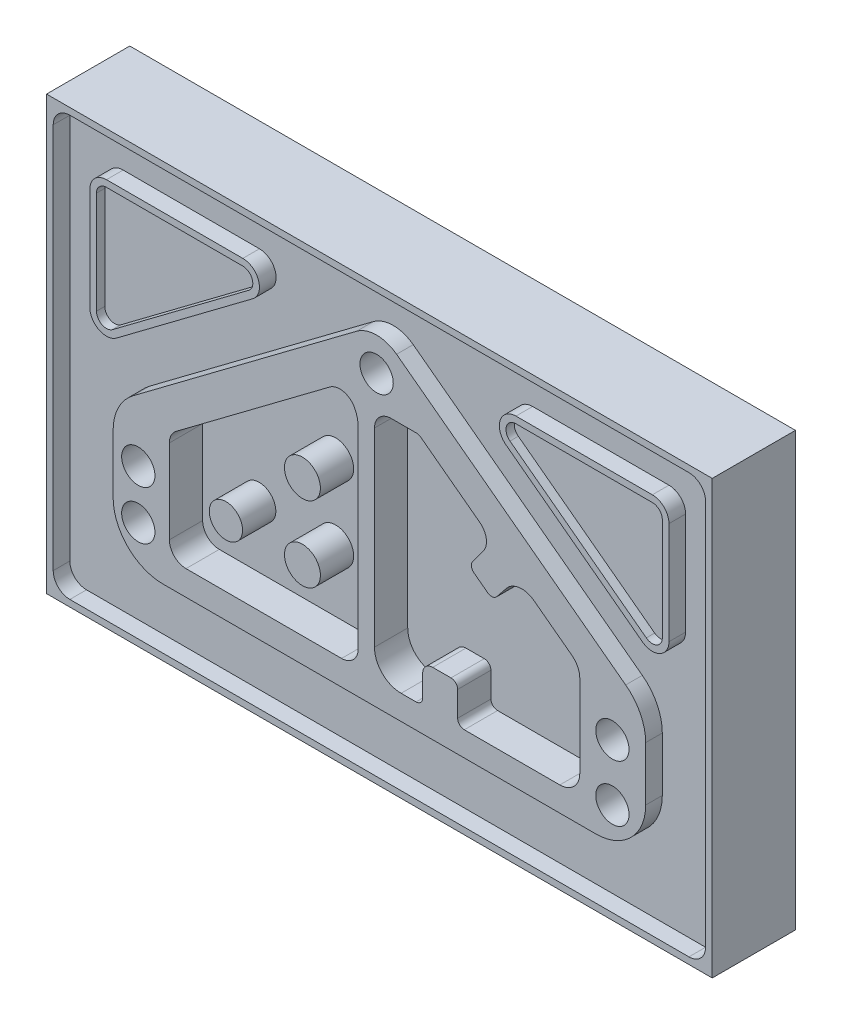
from build123d import *

# Parameters (mm, degrees)
BASE_TRIANGLE_DEPTH  = 50
SKETCH5_W            = 400
SKETCH5_H            = 260
BASE_RECTANGLE_DEPTH = 40
POCKETS_DEPTH        = 20
SKETCH3_R            = 10
CUT_HOLES_DEPTH      = 40
SKETCH4_R            = 10.786602673
SKETCH4_R_2          = 10
POCKET_BOSS_DEPTH    = 20
SKETCH6_W            = 400
SKETCH6_H            = 260
RIM_DEPTH            = 10
TRI_BOSS_DEPTH       = 10
TRI_POCK_S_DEPTH     = 5


with BuildPart() as part:
    # Sketch1 → Base - Triangle (new body)
    with BuildSketch(Plane.XY):
        with BuildLine():
            Line((-13.666666667, 109.75), (-148, 9))
            ThreePointArc((-148, 9), (-156.83281573, -1.583592135), (-160, -15))
            Line((-160, -15), (-160, -50))
            ThreePointArc((-160, -50), (-151.213203436, -71.213203436), (-130, -80))
            Line((-130, -80), (130, -80))
            ThreePointArc((130, -80), (151.213203436, -71.213203436), (160, -50))
            Line((160, -50), (160, -17.5))
            ThreePointArc((160, -17.5), (156.83281573, -4.083592135), (148, 6.5))
            Line((148, 6.5), (10.333333333, 109.75))
            ThreePointArc((10.333333333, 109.75), (-1.666666667, 113.75), (-13.666666667, 109.75))
        make_face()
    extrude(amount=BASE_TRIANGLE_DEPTH)

    # Sketch5 → Base - Rectangle (add)
    with BuildSketch(Plane.XY):
        with Locations((0, 10)):
            Rectangle(SKETCH5_W, SKETCH5_H)
    extrude(amount=BASE_RECTANGLE_DEPTH)

    # Sketch2 → Pockets (cut)
    with BuildSketch(Plane.XY.offset(50)):
        with BuildLine():
            Line((-126.20392244, -4.65294183), (-126.20392244, -55.061436747))
            ThreePointArc((-126.20392244, -55.061436747), (-123.274990252, -62.132504559), (-116.20392244, -65.061436747))
            Line((-116.20392244, -65.061436747), (-22.729187789, -65.061436747))
            ThreePointArc((-22.729187789, -65.061436747), (-15.658119977, -62.132504559), (-12.729187789, -55.061436747))
            Line((-12.729187789, -55.061436747), (-12.729187789, 60.20056332))
            ThreePointArc((-12.729187789, 60.20056332), (-13.262082788, 64.786609863), (-14.832370079, 69.12826828))
            ThreePointArc((-14.832370079, 69.12826828), (-21.478744287, 74.395841003), (-29.780778934, 72.6644158))
            Line((-29.780778934, 72.6644158), (-122.20392244, 3.34705817))
            ThreePointArc((-122.20392244, 3.34705817), (-125.14819435, -0.180805875), (-126.20392244, -4.65294183))
        make_face()
        with BuildLine():
            Line((-2.969097688, 64.72393548), (-2.969097688, -49.319676422))
            ThreePointArc((-2.969097688, -49.319676422), (1.717193813, -60.633384921), (13.030902312, -65.319676422))
            Line((13.030902312, -65.319676422), (22.011923396, -65.319676422))
            ThreePointArc((22.011923396, -65.319676422), (24.840350521, -64.148103547), (26.011923396, -61.319676422))
            Line((26.011923396, -61.319676422), (26.011923396, -48.319676422))
            ThreePointArc((26.011923396, -48.319676422), (27.769282709, -44.077035735), (32.011923396, -42.319676422))
            Line((32.011923396, -42.319676422), (43.011923396, -42.319676422))
            ThreePointArc((43.011923396, -42.319676422), (45.840350521, -43.491249298), (47.011923396, -46.319676422))
            Line((47.011923396, -46.319676422), (47.011923396, -61.319676422))
            ThreePointArc((47.011923396, -61.319676422), (48.183496271, -64.148103547), (51.011923396, -65.319676422))
            Line((51.011923396, -65.319676422), (108.417947751, -65.319676422))
            ThreePointArc((108.417947751, -65.319676422), (116.903229125, -61.804957797), (120.417947751, -53.319676422))
            Line((120.417947751, -53.319676422), (120.417947751, -3.813460813))
            ThreePointArc((120.417947751, -3.813460813), (119.151074043, 1.553102333), (115.617947751, 5.786539187))
            Line((115.617947751, 5.786539187), (92.782280857, 22.913289357))
            ThreePointArc((92.782280857, 22.913289357), (84.071541357, 25.217812286), (76.212563172, 20.810514877))
            Line((76.212563172, 20.810514877), (70.571566089, 13.760633559))
            ThreePointArc((70.571566089, 13.760633559), (67.951906694, 12.291534423), (65.04832686, 13.059708732))
            Line((65.04832686, 13.059708732), (56.830014172, 19.223443248))
            ThreePointArc((56.830014172, 19.223443248), (55.270216198, 21.857757823), (56.030014172, 24.823443248))
            Line((56.030014172, 24.823443248), (62.343956311, 33.242032767))
            ThreePointArc((62.343956311, 33.242032767), (64.243451248, 40.656246329), (60.343956311, 47.242032767))
            Line((60.343956311, 47.242032767), (24.768086026, 73.92393548))
            ThreePointArc((24.768086026, 73.92393548), (23.63299709, 74.518668672), (22.368086026, 74.72393548))
            Line((22.368086026, 74.72393548), (7.030902312, 74.72393548))
            ThreePointArc((7.030902312, 74.72393548), (-0.0401655, 71.795003292), (-2.969097688, 64.72393548))
        make_face()
    extrude(amount=-POCKETS_DEPTH, mode=Mode.SUBTRACT)

    # Sketch3 → Cut - Holes (cut)
    with BuildSketch(Plane.XY.offset(50)):
        with Locations((-144.880429534, -26.083370712)):
            Circle(SKETCH3_R)
        with Locations((-144.880429534, -55.454261033)):
            Circle(SKETCH3_R)
        with Locations((140, -26.083370712)):
            Circle(SKETCH3_R)
        with Locations((140, -60)):
            Circle(SKETCH3_R)
        with Locations((-1.666666667, 93.75)):
            Circle(SKETCH3_R)
    extrude(amount=-CUT_HOLES_DEPTH, mode=Mode.SUBTRACT)

    # Sketch4 → Pocket Boss' (add)
    with BuildSketch(Plane.XY.offset(30)):
        with Locations((-46.246176072, 17.161613861)):
            Circle(SKETCH4_R)
        with Locations((-46.246176072, -28.171767173)):
            Circle(SKETCH4_R)
        with Locations((-92.222494778, -28.171767173)):
            Circle(SKETCH4_R_2)
    extrude(amount=POCKET_BOSS_DEPTH)

    # Sketch6 → Rim (add)
    with BuildSketch(Plane.XY.offset(40)):
        with Locations((0, 10)):
            Rectangle(SKETCH6_W, SKETCH6_H)
        with BuildLine():
            Line((-196, 126), (-196, -106))
            ThreePointArc((-196, -106), (-193.071067812, -113.071067812), (-186, -116))
            Line((-186, -116), (186, -116))
            ThreePointArc((186, -116), (193.071067812, -113.071067812), (196, -106))
            Line((196, -106), (196, 126))
            ThreePointArc((196, 126), (193.071067812, 133.071067812), (186, 136))
            Line((186, 136), (-186, 136))
            ThreePointArc((-186, 136), (-193.071067812, 133.071067812), (-196, 126))
        make_face(mode=Mode.SUBTRACT)
    extrude(amount=RIM_DEPTH)

    # Sketch7 → Tri - Boss' (add)
    with BuildSketch(Plane.XY.offset(40)):
        with BuildLine():
            Line((-164, 113.448068866), (-82.069241512, 113.448068866))
            ThreePointArc((-82.069241512, 113.448068866), (-72.582408532, 106.610346526), (-76.069241512, 95.448068866))
            Line((-76.069241512, 95.448068866), (-158, 34))
            ThreePointArc((-158, 34), (-168.472135955, 33.05572809), (-174, 42))
            Line((-174, 42), (-174, 103.448068866))
            ThreePointArc((-174, 103.448068866), (-171.071067812, 110.519136678), (-164, 113.448068866))
        make_face()
        with BuildLine():
            Line((158, 34), (76.069241512, 95.448068866))
            ThreePointArc((76.069241512, 95.448068866), (72.582408532, 106.610346526), (82.069241512, 113.448068866))
            Line((82.069241512, 113.448068866), (164, 113.448068866))
            ThreePointArc((164, 113.448068866), (171.071067812, 110.519136678), (174, 103.448068866))
            Line((174, 103.448068866), (174, 42))
            ThreePointArc((174, 42), (168.472135955, 33.05572809), (158, 34))
        make_face()
    extrude(amount=TRI_BOSS_DEPTH)

    # Sketch8 → Tri - Pock's (cut)
    with BuildSketch(Plane.XY.offset(50)):
        with BuildLine():
            Line((-82.069241512, 109.448068866), (-164, 109.448068866))
            ThreePointArc((-164, 109.448068866), (-168.242640687, 107.690709553), (-170, 103.448068866))
            Line((-170, 103.448068866), (-170, 42))
            ThreePointArc((-170, 42), (-166.683281573, 36.633436854), (-160.4, 37.2))
            Line((-160.4, 37.2), (-78.469241512, 98.648068866))
            ThreePointArc((-78.469241512, 98.648068866), (-76.377141724, 105.345435462), (-82.069241512, 109.448068866))
        make_face()
        with BuildLine():
            Line((170, 42), (170, 103.448068866))
            ThreePointArc((170, 103.448068866), (168.242640687, 107.690709553), (164, 109.448068866))
            Line((164, 109.448068866), (82.069241512, 109.448068866))
            ThreePointArc((82.069241512, 109.448068866), (76.377141724, 105.345435462), (78.469241512, 98.648068866))
            Line((78.469241512, 98.648068866), (160.4, 37.2))
            ThreePointArc((160.4, 37.2), (166.683281573, 36.633436854), (170, 42))
        make_face()
    extrude(amount=-TRI_POCK_S_DEPTH, mode=Mode.SUBTRACT)


solid = part.part
